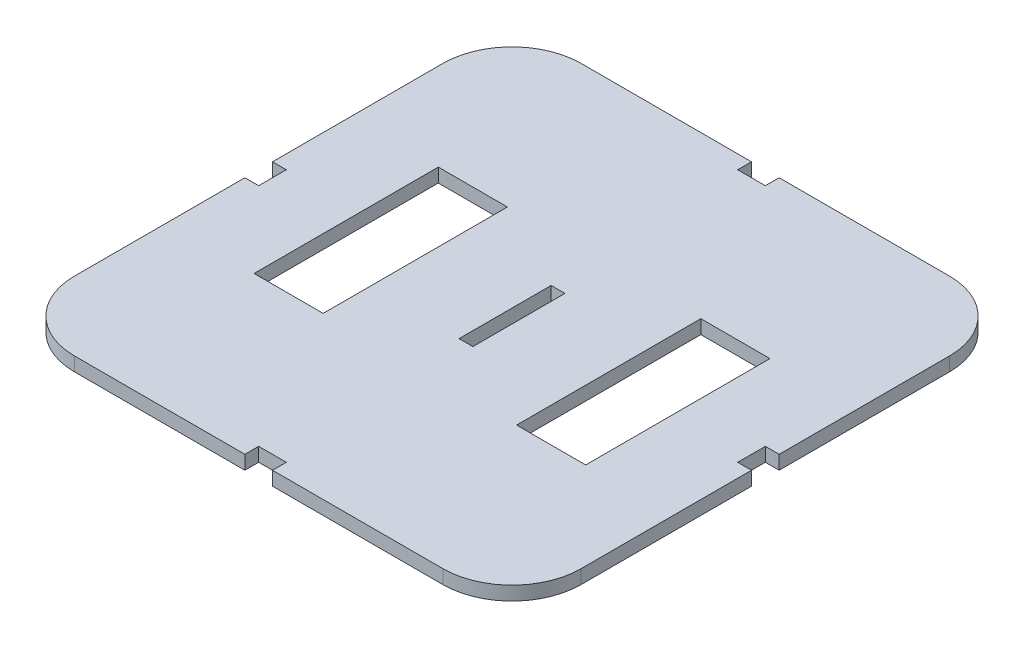
from build123d import *

# Parameters (mm, degrees)
EXTRUDE_3_DEPTH    = 3
FILLET1_R          = 15
SKETCH1_W          = 15
SKETCH1_H          = 40
SKETCH1_W_2        = 3
SKETCH1_H_2        = 20
CUT_EXTRUDE1_DEPTH = 10


with BuildPart() as part:
    # Эскиз4 → Бобышка-Вытянуть3 (new body)
    with BuildSketch(Plane(origin=(0, 0, 0), x_dir=(1, 0, 0), z_dir=(0, 1, 0))):
        Polygon((0, 52), (0, 0), (52, 0), (52, 3), (55, 3), (58, 3), (58, 0), (110, 0), (110, 52), (107, 52), (107, 55), (107, 58), (110, 58), (110, 110), (58, 110), (58, 107), (55, 107), (52, 107), (52, 110), (0, 110), (0, 58), (3, 58), (3, 55), (3, 52), align=None)
    extrude(amount=EXTRUDE_3_DEPTH)

    # Fillet1
    fillet1_edges = [part.edges().sort_by_distance(p)[0] for p in [
        (110, 1.5, 0),
        (0, 1.5, 0),
        (0, 1.5, -110),
        (110, 1.5, -110),
    ]]
    fillet(fillet1_edges, radius=FILLET1_R)

    # Sketch1 → Cut-Extrude1 (cut)
    with BuildSketch(Plane(origin=(0, 3, 0), x_dir=(1, 0, 0), z_dir=(0, 1, 0))):
        with Locations((26.5, 55)):
            Rectangle(SKETCH1_W, SKETCH1_H)
        with Locations((55, 55)):
            Rectangle(SKETCH1_W_2, SKETCH1_H_2)
        with Locations((83.5, 55)):
            Rectangle(SKETCH1_W, SKETCH1_H)
    extrude(amount=-CUT_EXTRUDE1_DEPTH, mode=Mode.SUBTRACT)


solid = part.part
